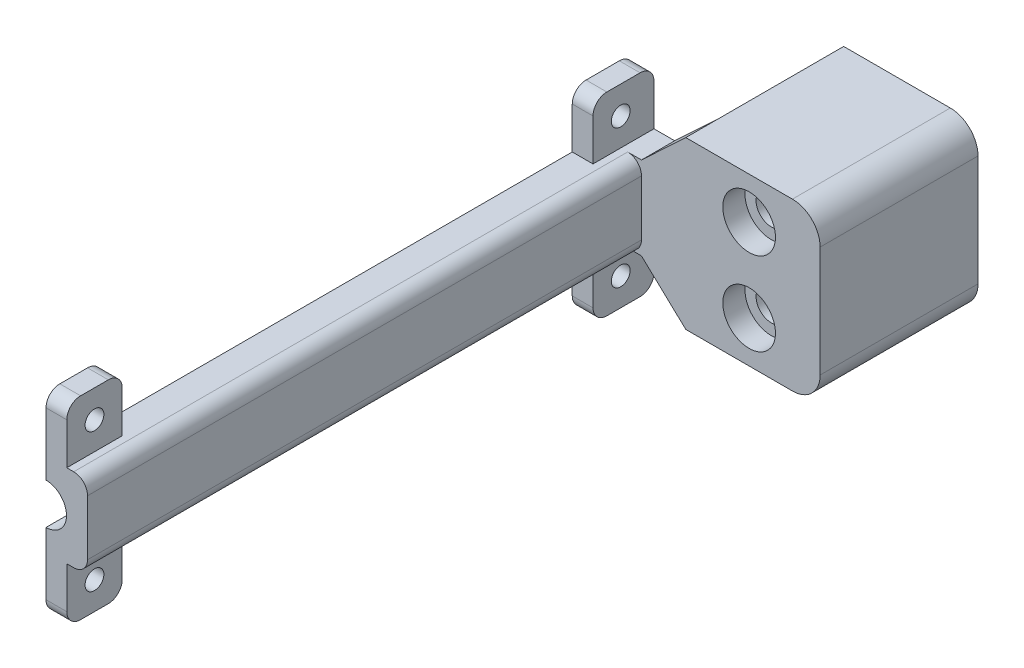
from build123d import *

# Parameters (mm, degrees)
SKETCH2_R               = 2.75
BOSS_EXTRUDE1_DEPTH     = 21.5
SKETCH3_R               = 2.75
BOSS_EXTRUDE2_DEPTH     = 2
SKETCH4_W               = 15
SKETCH4_H               = 15
SKETCH4_R               = 3.7
SKETCH4_R_2             = 2.75
BOSS_EXTRUDE3_DEPTH     = 5
SKETCH5_W               = 15
SKETCH5_H               = 15
SKETCH5_R               = 3.7
BOSS_EXTRUDE4_DEPTH     = 100
CUT_EXTRUDE1_DEPTH      = 138.203316286
CUT_EXTRUDE1_DEPTH_BACK = 138.203316286
SKETCH7_W               = 3.75
SKETCH7_H               = 10
BOSS_EXTRUDE5_DEPTH     = 10
SKETCH8_W               = 3.75
SKETCH8_H               = 10
BOSS_EXTRUDE6_DEPTH     = 10
CUT_EXTRUDE2_DEPTH      = 137.811229437
CUT_EXTRUDE2_DEPTH_BACK = 5
SKETCH9_R               = 1.7
BOSS_EXTRUDE7_START     = 1
BOSS_EXTRUDE7_DEPTH     = 1
FILLET1_R               = 2.5
SKETCH11_R              = 4.75
CUT_EXTRUDE3_DEPTH      = 4


with BuildPart() as part:
    # Sketch2 → Boss-Extrude1 (new body)
    with BuildSketch(Plane.XY):
        with BuildLine():
            ThreePointArc((37.5, -7.5), (41.035533906, -6.035533906), (42.5, -2.5))
            Line((42.5, -2.5), (42.5, 17.5))
            ThreePointArc((42.5, 17.5), (41.035533906, 21.035533906), (37.5, 22.5))
            Line((37.5, 22.5), (18.2530456, 22.5))
            ThreePointArc((18.2530456, 22.5), (20.865716684, 7.5), (18.2530456, -7.5))
            Line((18.2530456, -7.5), (37.5, -7.5))
        make_face()
        with Locations((29.682858342, 0)):
            Circle(SKETCH2_R, mode=Mode.SUBTRACT)
        with Locations((29.682858342, 15)):
            Circle(SKETCH2_R, mode=Mode.SUBTRACT)
    extrude(amount=BOSS_EXTRUDE1_DEPTH)

    # Sketch3 → Boss-Extrude2 (add)
    with BuildSketch(Plane.XY.offset(21.5)):
        with BuildLine():
            Line((18.2530456, -7.5), (37.5, -7.5))
            ThreePointArc((37.5, -7.5), (41.035533906, -6.035533906), (42.5, -2.5))
            Line((42.5, -2.5), (42.5, 17.5))
            ThreePointArc((42.5, 17.5), (41.035533906, 21.035533906), (37.5, 22.5))
            Line((37.5, 22.5), (18.2530456, 22.5))
            ThreePointArc((18.2530456, 22.5), (20.865716684, 7.5), (18.2530456, -7.5))
        make_face()
        with Locations((29.682858342, 0)):
            Circle(SKETCH3_R, mode=Mode.SUBTRACT)
        with Locations((29.682858342, 15)):
            Circle(SKETCH3_R, mode=Mode.SUBTRACT)
    extrude(amount=BOSS_EXTRUDE2_DEPTH)

    # Sketch4 → Boss-Extrude3 (add)
    # profile 1 of 3: a face of its own
    with BuildSketch(Plane.XY.offset(23.5)):
        with BuildLine():
            Line((10.25, 0), (10.25, 15))
            Line((10.25, 15), (18.2530456, 22.5))
            ThreePointArc((18.2530456, 22.5), (20.865716684, 7.5), (18.2530456, -7.5))
            Line((18.2530456, -7.5), (10.25, 0))
        make_face()
    # profile 2 of 3: a face of its own
    with BuildSketch(Plane.XY.offset(23.5)):
        with Locations((2.75, 7.5)):
            Rectangle(SKETCH4_W, SKETCH4_H)
        with Locations((2.75, 7.5)):
            Circle(SKETCH4_R, mode=Mode.SUBTRACT)
    # profile 3 of 3: a face of its own
    with BuildSketch(Plane.XY.offset(23.5)):
        with BuildLine():
            Line((37.5, 22.5), (18.2530456, 22.5))
            ThreePointArc((18.2530456, 22.5), (20.865716684, 7.5), (18.2530456, -7.5))
            Line((18.2530456, -7.5), (37.5, -7.5))
            ThreePointArc((37.5, -7.5), (41.035533906, -6.035533906), (42.5, -2.5))
            Line((42.5, -2.5), (42.5, 17.5))
            ThreePointArc((42.5, 17.5), (41.035533906, 21.035533906), (37.5, 22.5))
        make_face()
        with Locations((29.682858342, 15)):
            Circle(SKETCH4_R_2, mode=Mode.SUBTRACT)
        with Locations((29.682858342, 0)):
            Circle(SKETCH4_R_2, mode=Mode.SUBTRACT)
    extrude(amount=BOSS_EXTRUDE3_DEPTH)

    # Sketch5 → Boss-Extrude4 (add)
    with BuildSketch(Plane.XY.offset(28.5)):
        with Locations((2.75, 7.5)):
            Rectangle(SKETCH5_W, SKETCH5_H)
        with Locations((2.75, 7.5)):
            Circle(SKETCH5_R, mode=Mode.SUBTRACT)
    extrude(amount=BOSS_EXTRUDE4_DEPTH)

    # Sketch6 → Cut-Extrude1 (cut, two sides: drawn at the far end of the back side and taken through both)
    with BuildSketch(Plane.XY.offset(128.5).offset(-CUT_EXTRUDE1_DEPTH_BACK)):
        with BuildLine():
            ThreePointArc((2.75, 3.8), (-0.95, 7.5), (2.75, 11.2))
            Line((2.75, 11.2), (2.75, 15))
            Line((2.75, 15), (-4.75, 15))
            Line((-4.75, 15), (-4.75, 0))
            Line((-4.75, 0), (2.75, 0))
            Line((2.75, 0), (2.75, 3.8))
        make_face()
    extrude(amount=CUT_EXTRUDE1_DEPTH + CUT_EXTRUDE1_DEPTH_BACK, mode=Mode.SUBTRACT)

    # Sketch7 → Boss-Extrude5 (add)
    with BuildSketch(Plane.XZ):
        with Locations((4.625, 123.5)):
            Rectangle(SKETCH7_W, SKETCH7_H)
        with Locations((4.625, 28.5)):
            Rectangle(SKETCH7_W, SKETCH7_H)
    extrude(amount=BOSS_EXTRUDE5_DEPTH)

    # Sketch8 → Boss-Extrude6 (add)
    with BuildSketch(Plane(origin=(0, 15, 0), x_dir=(1, 0, 0), z_dir=(0, 1, 0))):
        with Locations((4.625, -123.5)):
            Rectangle(SKETCH8_W, SKETCH8_H)
        with Locations((4.625, -28.5)):
            Rectangle(SKETCH8_W, SKETCH8_H)
    extrude(amount=BOSS_EXTRUDE6_DEPTH)

    # Sketch9 → Cut-Extrude2 (cut, two sides: drawn at the far end of the back side and taken through both)
    with BuildSketch(Plane.ZY.offset(-2.75).offset(-CUT_EXTRUDE2_DEPTH_BACK)):
        with Locations((123.5, -5)):
            Circle(SKETCH9_R)
        with Locations(Location((123.5, 20, 0), (0, 0, 180))):
            Circle(SKETCH9_R)
        with Locations(Location((28.5, 20, 0), (0, 0, 180))):
            Circle(SKETCH9_R)
        with Locations((28.5, -5)):
            Circle(SKETCH9_R)
    extrude(amount=CUT_EXTRUDE2_DEPTH + CUT_EXTRUDE2_DEPTH_BACK, mode=Mode.SUBTRACT)

    # Sketch10 → Boss-Extrude7 (add)
    with BuildSketch(Plane(origin=(0, 0, 23.5), x_dir=(-1, 0, 0), z_dir=(0, 0, -1)).offset(BOSS_EXTRUDE7_START)):
        with BuildLine():
            Line((-2.75, -10), (-2.75, 3.8))
            ThreePointArc((-2.75, 3.8), (-6.45, 7.5), (-2.75, 11.2))
            Line((-2.75, 11.2), (-2.75, 25))
            Line((-2.75, 25), (-6.5, 25))
            Line((-6.5, 25), (-6.5, 15))
            Line((-6.5, 15), (-10.25, 15))
            Line((-10.25, 15), (-18.2530456, 22.5))
            ThreePointArc((-18.2530456, 22.5), (-20.865716684, 7.5), (-18.2530456, -7.5))
            Line((-18.2530456, -7.5), (-10.25, 0))
            Line((-10.25, 0), (-6.5, 0))
            Line((-6.5, 0), (-6.5, -10))
            Line((-6.5, -10), (-2.75, -10))
        make_face()
    extrude(amount=-BOSS_EXTRUDE7_DEPTH)

    # Fillet1
    fillet1_edges = [part.edges().sort_by_distance(p)[0] for p in [
        (4.625, -10, 22.5),
        (4.625, -10, 33.5),
        (4.625, 25, 22.5),
        (4.625, 25, 33.5),
        (4.625, 25, 118.5),
        (4.625, 25, 128.5),
        (4.625, -10, 118.5),
        (4.625, -10, 128.5),
        (10.25, 0, 78.5),
        (10.25, 15, 78.5),
    ]]
    fillet(fillet1_edges, radius=FILLET1_R)

    # Sketch11 → Cut-Extrude3 (cut)
    with BuildSketch(Plane.XY.offset(28.5)):
        with Locations((29.682858342, 15)):
            Circle(SKETCH11_R)
        with Locations((29.682858342, 0)):
            Circle(SKETCH11_R)
    extrude(amount=-CUT_EXTRUDE3_DEPTH, mode=Mode.SUBTRACT)


solid = part.part
